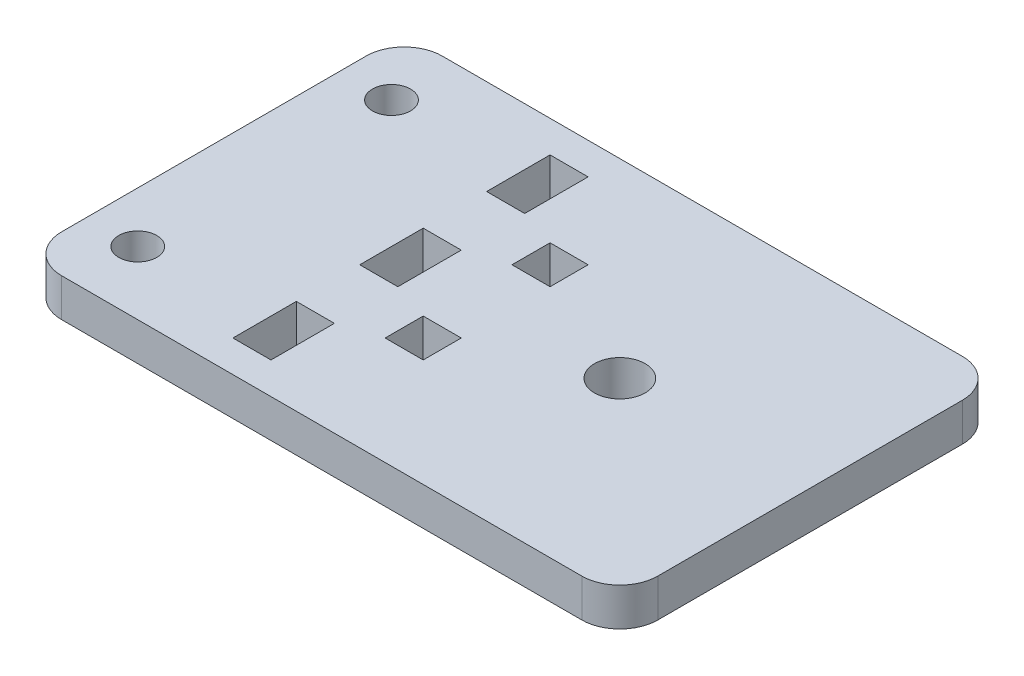
from build123d import *

# Parameters (mm, degrees)
SKETCH1_W           = 17
SKETCH1_H           = 30
BOSS_EXTRUDE1_DEPTH = 3
SKETCH2_W           = 3
SKETCH2_H           = 5
CUT_EXTRUDE1_DEPTH  = 3
SKETCH3_R           = 1.5
CUT_EXTRUDE2_DEPTH  = 3
FILLET1_R           = 3
SKETCH4_W           = 30
SKETCH4_H           = 30
BOSS_EXTRUDE2_DEPTH = 3
FILLET2_R           = 3
SKETCH5_R           = 2
CUT_EXTRUDE3_DEPTH  = 3
SKETCH6_W           = 3
SKETCH6_H           = 3
CUT_EXTRUDE4_DEPTH  = 10


with BuildPart() as part:
    # Sketch1 → Boss-Extrude1 (new body)
    with BuildSketch(Plane(origin=(0, 0, 0), x_dir=(1, 0, 0), z_dir=(0, 1, 0))):
        Rectangle(SKETCH1_W, SKETCH1_H)
    extrude(amount=BOSS_EXTRUDE1_DEPTH)

    # Sketch2 → Cut-Extrude1 (cut)
    with BuildSketch(Plane(origin=(0, 3, 0), x_dir=(1, 0, 0), z_dir=(0, 1, 0))):
        with Locations((7, 10)):
            Rectangle(SKETCH2_W, SKETCH2_H)
        with Locations((7, 0)):
            Rectangle(SKETCH2_W, SKETCH2_H)
        with Locations((7, -10)):
            Rectangle(SKETCH2_W, SKETCH2_H)
    extrude(amount=-CUT_EXTRUDE1_DEPTH, mode=Mode.SUBTRACT)

    # Sketch3 → Cut-Extrude2 (cut)
    with BuildSketch(Plane(origin=(0, 3, 0), x_dir=(1, 0, 0), z_dir=(0, 1, 0))):
        with Locations(Location((-4.5, 10, 0), (0, 0, 270))):
            Circle(SKETCH3_R)
        with Locations(Location((-4.5, -10, 0), (0, 0, 270))):
            Circle(SKETCH3_R)
    extrude(amount=-CUT_EXTRUDE2_DEPTH, mode=Mode.SUBTRACT)

    # Fillet1
    fillet1_edges = [part.edges().sort_by_distance(p)[0] for p in [
        (-8.5, 1.5, 15),
        (-8.5, 1.5, -15),
    ]]
    fillet(fillet1_edges, radius=FILLET1_R)

    # Sketch4 → Boss-Extrude2 (add)
    with BuildSketch(Plane(origin=(0, 3, 0), x_dir=(1, 0, 0), z_dir=(0, 1, 0))):
        with Locations((23.5, 0)):
            Rectangle(SKETCH4_W, SKETCH4_H)
    extrude(amount=-BOSS_EXTRUDE2_DEPTH)

    # Fillet2
    fillet2_edges = [part.edges().sort_by_distance(p)[0] for p in [
        (38.5, 1.5, 15),
        (38.5, 1.5, -15),
    ]]
    fillet(fillet2_edges, radius=FILLET2_R)

    # Sketch5 → Cut-Extrude3 (cut)
    with BuildSketch(Plane(origin=(0, 3, 0), x_dir=(1, 0, 0), z_dir=(0, 1, 0))):
        with Locations(Location((23.5, 0, 0), (0, 0, 270))):
            Circle(SKETCH5_R)
    extrude(amount=-CUT_EXTRUDE3_DEPTH, mode=Mode.SUBTRACT)

    # Sketch6 → Cut-Extrude4 (cut)
    with BuildSketch(Plane(origin=(0, 3, 0), x_dir=(1, 0, 0), z_dir=(0, 1, 0))):
        with Locations((13, 5)):
            Rectangle(SKETCH6_W, SKETCH6_H)
        with Locations((13, -5)):
            Rectangle(SKETCH6_W, SKETCH6_H)
    extrude(amount=-CUT_EXTRUDE4_DEPTH, mode=Mode.SUBTRACT)


solid = part.part
